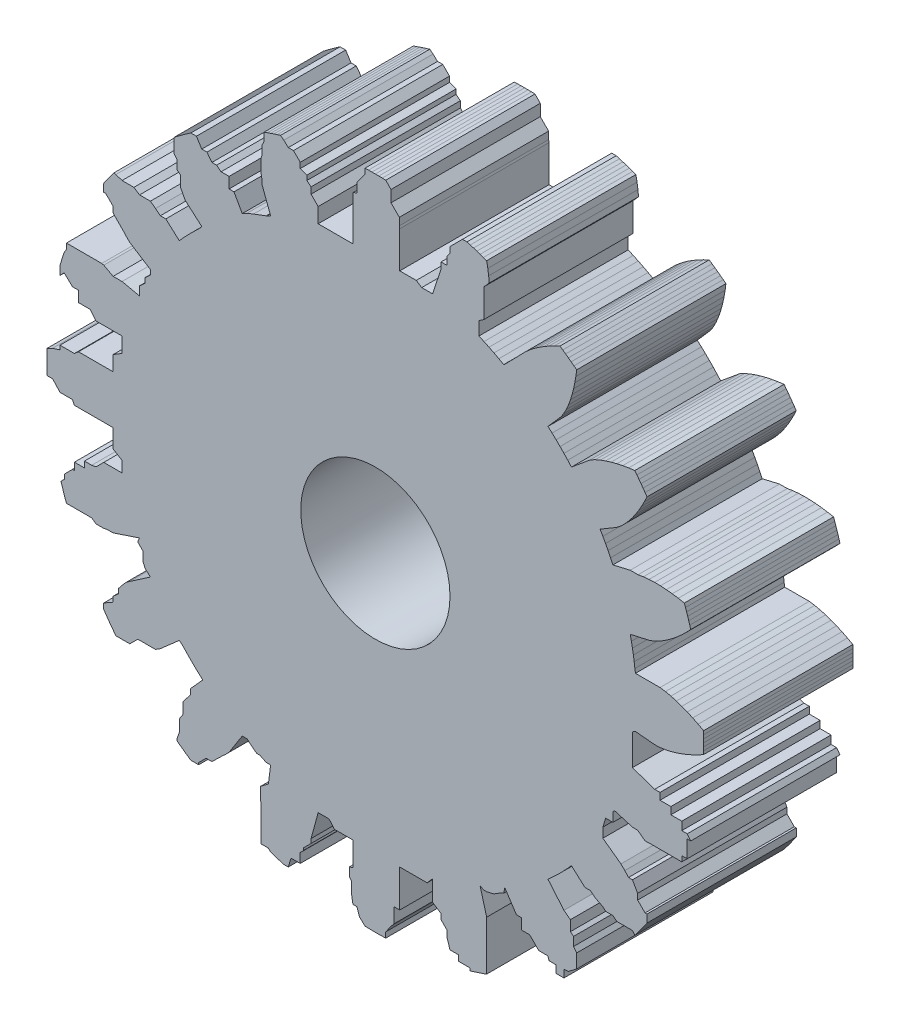
from build123d import *

# Parameters (mm, degrees)
EXTRUDE_1_DEPTH     = 10
SKETCH_2_R          = 5
CUT_EXTRUDE_1_DEPTH = 33.680269277


with BuildPart() as part:
    # 草图1 → 凸台-拉伸1 (new body)
    with BuildSketch(Plane.XY):
        Polygon((17.423652167, -1.632894724), (18.711859849, -1.753621854), (19.07084698, -1.740339671), (19.433229611, -1.687152497), (19.797485927, -1.606601859), (20.162874452, -1.502879305), (20.528829783, -1.378276392), (20.894861959, -1.234260669), (21.260520805, -1.071858342), (21.625379668, -0.891830064), (21.989026862, -0.69476445), (21.995122825, -0.46321909), (21.998780672, -0.231622382), (22, 0), (21.998780672, 0.231622382), (21.995122825, 0.46321909), (21.989026862, 0.69476445), (21.625379668, 0.891830064), (21.260520805, 1.071858342), (20.894861959, 1.234260669), (20.528829783, 1.378276392), (20.162874452, 1.502879305), (19.797485927, 1.606601859), (19.433229611, 1.687152497), (19.07084698, 1.740339671), (17.423652167, 1.740339671), (17.38509845, 2.002086883), (17.338722759, 2.370378256), (17.28454596, 2.737603138), (17.222592429, 3.103596307), (17.152890038, 3.468193093), (17.07547015, 3.831229456), (18.337935196, 4.114489198), (18.675247826, 4.23805443), (19.003458448, 4.400620829), (19.324995275, 4.58979043), (19.64044838, 4.801347705), (19.949988165, 5.032938534), (20.253602146, 5.283015788), (20.551179295, 5.550464377), (20.842548897, 5.834429033), (21.127501307, 6.134222733), (21.06174746, 6.356319212), (20.993658961, 6.577711107), (20.923243358, 6.798373876), (20.850508457, 7.018283059), (20.775462318, 7.23741428), (20.698113262, 7.455743248), (20.291367605, 7.530790621), (19.888734408, 7.589260099), (19.490787101, 7.630719093), (19.098166509, 7.654576021), (18.711617889, 7.659994017), (18.33206072, 7.645728764), (17.960740861, 7.609775582), (17.599658757, 7.548377198), (17.07547015, 7.548377198), (15.915532296, 7.276388647), (15.7576181, 7.61232368), (15.592614173, 7.944833745), (15.420594754, 8.273769239), (15.241637239, 8.598982166), (15.055822144, 8.920326203), (16.168965678, 9.57984538), (16.451585296, 9.801598234), (16.713496367, 10.057630728), (16.96083944, 10.336902053), (17.195478378, 10.635585349), (17.418302706, 10.951494369), (17.629778639, 11.283153852), (17.830145167, 11.629468971), (18.019504221, 11.989573566), (18.197868719, 12.362749455), (18.066701508, 12.553656703), (17.93353164, 12.743172404), (17.798373876, 12.93127555), (17.661243199, 13.117945291), (17.522154809, 13.303160934), (17.381124124, 13.486901949), (16.971095102, 13.432584922), (16.570100115, 13.3637722), (16.178818201, 13.280229565), (15.798041632, 13.181592417), (15.428737796, 13.067295145), (15.072165682, 12.936438467), (14.730129655, 12.787500812), (14.405693311, 12.617526973), (13.13623927, 11.562405366), (12.888042951, 11.838426791), (12.634047992, 12.109121824), (12.374368671, 12.374368671), (12.109121824, 12.634047992), (11.838426791, 12.888042951), (11.562405366, 13.13623927), (12.417265144, 14.10745955), (12.617526973, 14.405693311), (12.787500812, 14.730129655), (12.936438467, 15.072165682), (13.067295145, 15.428737796), (13.181592417, 15.798041632), (13.280229565, 16.178818201), (13.3637722, 16.570100115), (13.432584922, 16.971095102), (13.486901949, 17.381124124), (13.303160934, 17.522154809), (13.117945291, 17.661243199), (12.93127555, 17.798373876), (12.743172404, 17.93353164), (12.553656703, 18.066701508), (12.362749455, 18.197868719), (11.989573566, 18.019504221), (11.629468971, 17.830145167), (11.283153852, 17.629778639), (10.951494369, 17.418302706), (10.635585349, 17.195478378), (10.336902053, 16.96083944), (10.057630728, 16.713496367), (9.801598234, 16.451585296), (8.67326143, 15.297341564), (8.598982166, 15.241637239), (8.273769239, 15.420594754), (7.944833745, 15.592614173), (7.61232368, 15.7576181), (7.276388647, 15.915532296), (6.937179791, 16.066285711), (6.937179791, 16.96083944), (7.276388647, 17.195478378), (7.276388647, 17.629778639), (7.276388647, 17.830145167), (7.276388647, 18.197868719), (7.276388647, 19.098166509), (7.630719093, 19.490787101), (7.589260099, 19.888734408), (7.530790621, 20.291367605), (7.455743248, 20.698113262), (7.23741428, 20.775462318), (7.018283059, 20.850508457), (6.798373876, 20.923243358), (6.577711107, 20.993658961), (6.356319212, 21.06174746), (6.134222733, 21.127501307), (5.834429033, 21.127501307), (5.557436183, 20.850508457), (4.998295331, 20.291367605), (4.998295331, 19.888734408), (4.801347705, 19.64044838), (4.801347705, 19.098166509), (4.400620829, 19.098166509), (4.400620829, 18.675247826), (3.831229456, 16.96083944), (3.468193093, 16.96083944), (3.103596307, 16.96083944), (2.737603138, 17.195478378), (2.370378256, 17.195478378), (2.002086883, 17.195478378), (1.632894724, 17.195478378), (1.632894724, 18.675247826), (1.632894724, 19.098166509), (1.632894724, 19.64044838), (1.606601859, 19.797485927), (1.606601859, 19.888734408), (1.606601859, 20.291367605), (1.047461007, 20.850508457), (1.047461007, 21.127501307), (1.047461007, 21.625379668), (0.69476445, 21.989026862), (0.46321909, 21.995122825), (0.231622382, 21.998780672), (0, 22), (-0.231622382, 21.998780672), (-0.46321909, 21.995122825), (-0.69476445, 21.989026862), (-0.69476445, 21.625379668), (-1.071858342, 21.127501307), (-1.234260669, 20.894861959), (-1.234260669, 20.291367605), (-1.502879305, 20.162874452), (-1.502879305, 19.797485927), (-1.502879305, 19.64044838), (-1.502879305, 19.098166509), (-1.502879305, 17.195478378), (-2.002086883, 17.195478378), (-2.370378256, 17.195478378), (-2.737603138, 17.195478378), (-3.103596307, 17.195478378), (-3.468193093, 17.195478378), (-3.831229456, 17.195478378), (-3.831229456, 18.197868719), (-4.308608562, 18.675247826), (-4.308608562, 19.098166509), (-4.58979043, 19.324995275), (-4.58979043, 19.64044838), (-5.032938534, 19.797485927), (-5.032938534, 20.162874452), (-5.485853877, 20.615789795), (-5.834429033, 20.615789795), (-6.134222733, 20.894861959), (-6.356319212, 21.06174746), (-6.577711107, 20.993658961), (-6.798373876, 20.923243358), (-7.018283059, 20.850508457), (-7.23741428, 20.775462318), (-7.455743248, 20.698113262), (-7.455743248, 20.162874452), (-7.589260099, 19.888734408), (-7.589260099, 19.324995275), (-7.654576021, 19.098166509), (-7.654576021, 18.675247826), (-7.654576021, 18.197868719), (-7.609775582, 17.960740861), (-7.609775582, 17.629778639), (-7.018283059, 16.066285711), (-7.276388647, 15.915532296), (-7.314029321, 15.915532296), (-7.731444112, 15.7576181), (-8.1675992, 15.592614173), (-8.598982166, 15.420594754), (-8.920326203, 15.241637239), (-9.470630413, 16.229787841), (-9.801598234, 16.229787841), (-9.801598234, 16.96083944), (-10.336902053, 16.96083944), (-10.635585349, 17.195478378), (-10.951494369, 17.195478378), (-11.283153852, 17.629778639), (-11.629468971, 17.629778639), (-11.989573566, 18.197868719), (-12.362749455, 18.197868719), (-12.553656703, 18.066701508), (-12.743172404, 17.93353164), (-12.93127555, 17.798373876), (-13.117945291, 17.661243199), (-13.303160934, 17.522154809), (-13.486901949, 17.381124124), (-13.486901949, 17.195478378), (-13.486901949, 16.451585296), (-13.280229565, 16.178818201), (-13.280229565, 15.592614173), (-13.067295145, 15.428737796), (-13.067295145, 15.241637239), (-13.067295145, 14.730129655), (-12.743172404, 14.10745955), (-11.629468971, 13.13623927), (-11.838426791, 12.888042951), (-12.109121824, 12.634047992), (-12.374368671, 12.374368671), (-12.634047992, 12.109121824), (-12.888042951, 11.838426791), (-13.13623927, 11.562405366), (-14.039231182, 12.374368671), (-14.405693311, 12.374368671), (-14.730129655, 12.634047992), (-15.072165682, 12.888042951), (-15.428737796, 12.888042951), (-15.798041632, 12.888042951), (-16.178818201, 13.13623927), (-16.570100115, 13.13623927), (-16.971095102, 13.13623927), (-17.381124124, 13.280229565), (-17.522154809, 13.303160934), (-17.661243199, 13.117945291), (-17.798373876, 12.93127555), (-17.93353164, 12.743172404), (-18.066701508, 12.553656703), (-18.197868719, 12.362749455), (-18.197868719, 11.838426791), (-18.066701508, 11.838426791), (-17.570603604, 11.342328887), (-17.570603604, 10.951494369), (-16.971095102, 10.336902053), (-16.96083944, 10.336902053), (-16.713496367, 10.057630728), (-16.451585296, 9.801598234), (-15.072165682, 8.920326203), (-15.072165682, 8.598982166), (-15.428737796, 8.273769239), (-15.428737796, 7.944833745), (-15.798041632, 7.61232368), (-15.798041632, 7.276388647), (-15.798041632, 7.018283059), (-16.971095102, 7.276388647), (-17.570603604, 7.276388647), (-18.197868719, 7.61232368), (-18.33206072, 7.645728764), (-18.711617889, 7.645728764), (-19.098166509, 7.645728764), (-19.490787101, 7.645728764), (-19.888734408, 7.645728764), (-20.291367605, 7.645728764), (-20.698113262, 7.645728764), (-20.698113262, 7.276388647), (-20.850508457, 7.018283059), (-20.923243358, 6.798373876), (-20.993658961, 6.577711107), (-21.06174746, 6.356319212), (-21.127501307, 6.134222733), (-21.127501307, 5.550464377), (-20.850508457, 5.842343555), (-20.291367605, 5.311719824), (-19.888734408, 5.311719824), (-19.888734408, 4.58979043), (-19.490787101, 4.58979043), (-19.098166509, 4.58979043), (-18.711617889, 4.114489198), (-16.971095102, 4.114489198), (-16.971095102, 3.468193093), (-16.971095102, 3.103596307), (-17.570603604, 2.737603138), (-17.570603604, 2.370378256), (-17.570603604, 2.002086883), (-17.570603604, 1.740339671), (-18.711617889, 1.740339671), (-19.098166509, 1.740339671), (-19.490787101, 1.740339671), (-19.888734408, 1.740339671), (-20.162874452, 1.502879305), (-20.291367605, 1.502879305), (-21.127501307, 1.502879305), (-21.127501307, 1.234260669), (-21.625379668, 1.071858342), (-21.989026862, 0.891830064), (-21.989026862, 0.69476445), (-21.989026862, 0), (-22, 0), (-21.998780672, -0.231622382), (-21.995122825, -0.46321909), (-21.989026862, -0.69476445), (-21.625379668, -0.69476445), (-21.127501307, -1.234260669), (-20.894861959, -1.234260669), (-20.291367605, -1.234260669), (-20.162874452, -1.502879305), (-19.888734408, -1.502879305), (-19.490787101, -1.502879305), (-19.098166509, -1.502879305), (-17.570603604, -1.502879305), (-17.570603604, -1.753621854), (-17.570603604, -2.370378256), (-17.570603604, -2.737603138), (-16.971095102, -3.103596307), (-16.971095102, -3.468193093), (-16.971095102, -3.831229456), (-18.197868719, -3.831229456), (-18.711617889, -4.344978626), (-19.003458448, -4.400620829), (-19.490787101, -4.400620829), (-19.490787101, -4.801347705), (-20.162874452, -4.801347705), (-20.162874452, -5.283015788), (-20.291367605, -5.283015788), (-20.842664873, -5.834313057), (-20.842664873, -6.134222733), (-21.06174746, -6.356319212), (-20.993658961, -6.577711107), (-20.923243358, -6.798373876), (-20.850508457, -7.018283059), (-20.775462318, -7.23741428), (-20.698113262, -7.455743248), (-20.291367605, -7.455743248), (-20.162874452, -7.455743248), (-19.490787101, -7.455743248), (-19.003458448, -7.455743248), (-18.711617889, -7.659994017), (-18.197868719, -7.659994017), (-17.960740861, -7.609775582), (-17.570603604, -7.609775582), (-15.798041632, -7.018283059), (-15.915532296, -7.276388647), (-15.915532296, -7.314029321), (-15.5695676, -7.659994017), (-15.5695676, -8.273769239), (-15.428737796, -8.598982166), (-15.072165682, -8.920326203), (-15.915532296, -9.497645722), (-16.451585296, -9.864596292), (-16.713496367, -10.057630728), (-16.96083944, -10.336902053), (-17.195478378, -10.635585349), (-17.195478378, -10.951494369), (-17.570603604, -11.283153852), (-17.570603604, -11.629468971), (-18.197868719, -11.989573566), (-18.197868719, -12.362749455), (-18.066701508, -12.553656703), (-17.93353164, -12.743172404), (-17.798373876, -12.93127555), (-17.661243199, -13.117945291), (-17.522154809, -13.303160934), (-17.381124124, -13.486901949), (-17.195478378, -13.486901949), (-16.713496367, -13.486901949), (-16.451585296, -13.486901949), (-15.915532296, -12.950848949), (-15.428737796, -12.950848949), (-15.072165682, -12.950848949), (-14.730129655, -12.950848949), (-14.405693311, -12.743172404), (-13.13623927, -11.629468971), (-12.888042951, -11.838426791), (-12.634047992, -12.109121824), (-12.374368671, -12.374368671), (-12.109121824, -12.634047992), (-11.838426791, -12.888042951), (-11.562405366, -13.13623927), (-12.374368671, -14.039231182), (-12.374368671, -14.405693311), (-12.634047992, -14.730129655), (-12.888042951, -15.072165682), (-12.888042951, -15.428737796), (-12.888042951, -15.798041632), (-13.13623927, -16.178818201), (-13.13623927, -16.570100115), (-13.13623927, -16.971095102), (-13.280229565, -17.381124124), (-13.303160934, -17.522154809), (-13.117945291, -17.661243199), (-12.93127555, -17.798373876), (-12.743172404, -17.93353164), (-12.553656703, -18.066701508), (-12.362749455, -18.197868719), (-11.838426791, -18.197868719), (-11.838426791, -18.066701508), (-11.342328887, -17.570603604), (-10.951494369, -17.570603604), (-10.336902053, -16.971095102), (-10.336902053, -16.96083944), (-10.057630728, -16.713496367), (-9.801598234, -16.451585296), (-8.920326203, -15.072165682), (-8.598982166, -15.072165682), (-8.1675992, -15.428737796), (-7.944833745, -15.592614173), (-7.731444112, -15.592614173), (-7.314029321, -15.798041632), (-7.018283059, -15.798041632), (-7.16615619, -16.971095102), (-7.709144907, -17.392512429), (-7.709144907, -18.197868719), (-7.645728764, -18.33206072), (-7.645728764, -18.711617889), (-7.645728764, -19.098166509), (-7.645728764, -19.490787101), (-7.645728764, -19.888734408), (-7.645728764, -20.291367605), (-7.645728764, -20.698113262), (-7.16615619, -20.698113262), (-7.018283059, -20.850508457), (-6.798373876, -20.923243358), (-6.577711107, -20.993658961), (-6.356319212, -21.06174746), (-6.134222733, -21.127501307), (-5.834429033, -21.127501307), (-5.654669506, -20.520328342), (-5.032938534, -20.520328342), (-5.032938534, -19.888734408), (-4.801347705, -19.64044838), (-4.801347705, -19.490787101), (-4.308608562, -18.998047958), (-4.308608562, -18.711617889), (-3.831229456, -16.971095102), (-3.468193093, -16.971095102), (-3.103596307, -16.971095102), (-2.737603138, -17.392512429), (-2.370378256, -17.392512429), (-2.002086883, -17.392512429), (-1.502879305, -17.392512429), (-1.502879305, -18.998047958), (-1.740339671, -19.07084698), (-1.740339671, -19.64044838), (-1.606601859, -19.797485927), (-1.606601859, -19.888734408), (-1.606601859, -20.520328342), (-1.502879305, -21.127501307), (-1.234260669, -21.127501307), (-1.071858342, -21.625379668), (-0.69476445, -21.989026862), (-0.46321909, -21.995122825), (-0.231622382, -21.998780672), (0, -22), (0.231622382, -21.998780672), (0.46321909, -21.995122825), (0.69476445, -21.989026862), (0.69476445, -21.625379668), (1.047461007, -21.127501307), (1.234260669, -20.894861959), (1.234260669, -20.520328342), (1.234260669, -19.888734408), (1.632894724, -19.888734408), (1.632894724, -19.64044838), (1.632894724, -18.998047958), (1.632894724, -17.392512429), (2.002086883, -17.392512429), (2.370378256, -17.392512429), (2.737603138, -17.392512429), (3.103596307, -17.392512429), (3.468193093, -17.392512429), (3.831229456, -16.971095102), (3.831229456, -18.33206072), (4.400620829, -18.711617889), (4.400620829, -19.003458448), (4.400620829, -19.07084698), (4.801347705, -19.471573856), (4.801347705, -19.888734408), (4.998295331, -20.520328342), (5.557436183, -20.520328342), (5.557436183, -20.894861959), (6.356319212, -20.894861959), (6.356319212, -21.06174746), (6.577711107, -20.993658961), (6.798373876, -20.923243358), (7.018283059, -20.850508457), (7.23741428, -20.775462318), (7.455743248, -20.698113262), (7.455743248, -20.520328342), (7.455743248, -19.888734408), (7.455743248, -19.471573856), (7.455743248, -19.07084698), (7.455743248, -18.711617889), (7.455743248, -18.33206072), (7.455743248, -18.197868719), (7.455743248, -17.392512429), (7.018283059, -15.798041632), (7.276388647, -15.915532296), (7.455743248, -15.915532296), (7.944833745, -15.798041632), (8.273769239, -15.592614173), (8.598982166, -15.428737796), (8.67326143, -15.072165682), (9.448336835, -16.25512978), (9.801598234, -16.25512978), (9.801598234, -16.971095102), (10.057630728, -16.971095102), (10.336902053, -16.971095102), (10.951494369, -17.585687418), (11.562405366, -17.585687418), (11.629468971, -17.830145167), (12.109121824, -17.830145167), (12.109121824, -18.33206072), (12.634047992, -18.33206072), (12.634047992, -17.830145167), (12.93127555, -17.798373876), (13.117945291, -17.661243199), (13.303160934, -17.522154809), (13.486901949, -17.381124124), (13.486901949, -16.971095102), (13.486901949, -16.451585296), (13.280229565, -16.178818201), (13.280229565, -15.592614173), (13.067295145, -15.428737796), (13.067295145, -15.072165682), (13.067295145, -14.730129655), (12.634047992, -14.405693311), (11.562405366, -13.13623927), (11.838426791, -12.888042951), (12.109121824, -12.634047992), (12.374368671, -12.374368671), (12.634047992, -12.109121824), (12.888042951, -11.838426791), (13.13623927, -11.562405366), (14.039231182, -12.374368671), (14.405693311, -12.374368671), (14.730129655, -12.634047992), (15.241637239, -12.888042951), (15.428737796, -13.067295145), (15.915532296, -13.067295145), (16.178818201, -13.280229565), (16.451585296, -13.280229565), (17.222592429, -13.280229565), (17.381124124, -13.486901949), (17.522154809, -13.303160934), (17.661243199, -13.117945291), (17.798373876, -12.93127555), (17.93353164, -12.743172404), (18.066701508, -12.553656703), (18.197868719, -12.362749455), (18.197868719, -11.838426791), (18.066701508, -11.838426791), (17.570603604, -11.342328887), (17.570603604, -10.951494369), (17.222592429, -10.336902053), (16.96083944, -10.336902053), (16.713496367, -10.057630728), (16.451585296, -9.801598234), (15.241637239, -8.920326203), (15.241637239, -8.598982166), (15.241637239, -8.273769239), (15.428737796, -7.659994017), (15.915532296, -7.659994017), (15.915532296, -7.018283059), (16.066285711, -6.937179791), (17.222592429, -7.284536319), (17.570603604, -7.284536319), (18.066701508, -7.659994017), (18.33206072, -7.645728764), (18.711859849, -7.645728764), (19.07084698, -7.645728764), (19.433229611, -7.645728764), (19.797485927, -7.645728764), (20.162874452, -7.645728764), (20.528829783, -7.645728764), (20.528829783, -7.284536319), (20.894861959, -7.284536319), (20.894861959, -6.937179791), (20.894861959, -6.798373876), (20.894861959, -6.134222733), (21.127501307, -6.134222733), (20.894861959, -5.834313057), (20.528829783, -5.834313057), (20.528829783, -5.283015788), (19.797485927, -5.283015788), (19.797485927, -4.801347705), (19.07084698, -4.801347705), (19.07084698, -4.344978626), (18.711859849, -4.344978626), (17.222592429, -3.831229456), (17.222592429, -3.468193093), (17.222592429, -3.103596307), (17.222592429, -2.737603138), (17.222592429, -2.370378256), (17.222592429, -1.753621854), align=None)
    extrude(amount=EXTRUDE_1_DEPTH)

    # 草图2 → 切除-拉伸1 (cut, through all)
    with BuildSketch(Plane.XY):
        Circle(SKETCH_2_R)
    extrude(amount=CUT_EXTRUDE_1_DEPTH, mode=Mode.SUBTRACT)


solid = part.part
